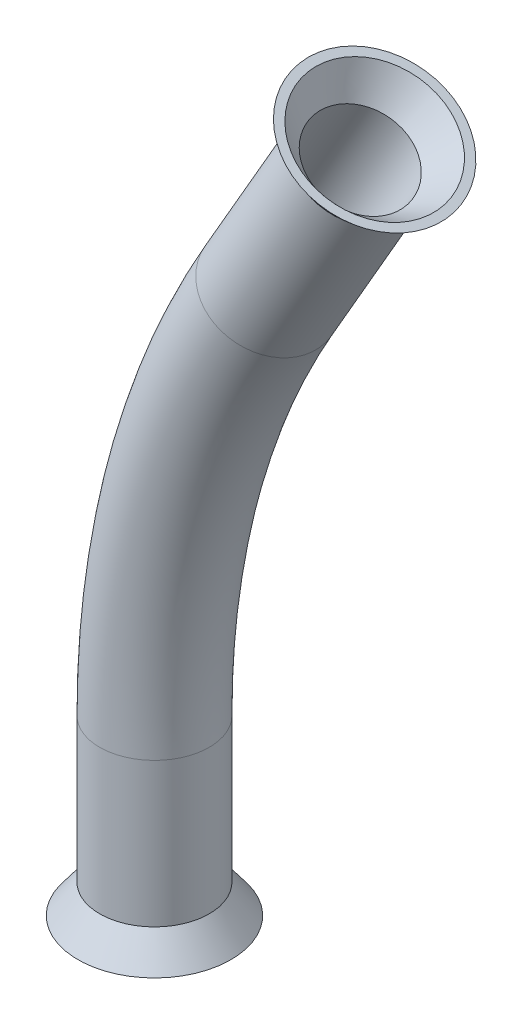
from build123d import *

# Parameters (mm, degrees)
SKETCH1_R           = 4.826
SKETCH1_R_2         = 4.064
SKETCH3_R           = 4.826
BOSS_EXTRUDE1_DEPTH = 2.54
BOSS_EXTRUDE1_DRAFT = -37
SKETCH5_R           = 4.826
BOSS_EXTRUDE2_DEPTH = 2.54
BOSS_EXTRUDE2_DRAFT = -37


with BuildPart() as part:
    # Sweep1: sweep along a path in Sketch2
    with BuildLine(Plane.XY) as sweep1_path:
        Line((0, 0), (0, 12.7))
        ThreePointArc((0, 12.7), (2.549187543, 32.063001763), (10.023027253, 50.106446956))
        Line((10.023027253, 50.106446956), (18.12241613, 64.135))
    # Sketch1 → Sweep1 (sweep)
    with BuildSketch(Plane(origin=(0, 0, 0), x_dir=(1, 0, 0), z_dir=(0, 1, 0))):
        Circle(SKETCH1_R)
        Circle(SKETCH1_R_2, mode=Mode.SUBTRACT)
    sweep(path=sweep1_path.line)


with BuildPart() as boss_extrude1_tool:
    # Sketch3 → Boss-Extrude1 (with draft: the straight prism first)
    with BuildSketch(Plane.XZ):
        with Locations(Location((0, 0, 0), (0, 0, 180))):
            Circle(SKETCH3_R)
    extrude(amount=BOSS_EXTRUDE1_DEPTH)
    # Boss-Extrude1: the draft: its side faces are tilted about the plane it starts from
    boss_extrude1_sides = [boss_extrude1_tool.faces().sort_by_distance(p)[0] for p in [
        (4.826, -1.27, 0),
    ]]
    draft(boss_extrude1_sides, Plane.XZ, BOSS_EXTRUDE1_DRAFT)


with BuildPart() as part_1:
    add(part.part)

    # Boss-Extrude1: add boss_extrude1_tool
    add(boss_extrude1_tool.part)

    # Cut-Extrude1 cone 1 section (through the dimple's axis) → Cut-Extrude1 (revolve, cut)
    with BuildSketch(Plane(origin=(0, -2.54, 0), x_dir=(0, 0, -1), z_dir=(1, 0, 0))):
        Polygon((0, 0), (5.978027287, 0), (0, 7.933110155), align=None)
    revolve(axis=Axis((0, -2.54, 0), (0, 1, 0)), mode=Mode.SUBTRACT)


with BuildPart() as boss_extrude2_tool:
    # Sketch5 → Boss-Extrude2 (with draft: the straight prism first)
    with BuildSketch(Plane(origin=(32.301873668, 55.948486373, 0), x_dir=(0, 0, -1), z_dir=(0.5000000000000008, 0.8660254037844382, 0))):
        with Locations(Location((0, 16.373027253, 0), (0, 0, 90))):
            Circle(SKETCH5_R)
    extrude(amount=BOSS_EXTRUDE2_DEPTH)
    # Boss-Extrude2: the draft: its side faces are tilted about the plane it starts from
    boss_extrude2_sides = [boss_extrude2_tool.faces().sort_by_distance(p)[0] for p in [
        (22.936854729, 62.821852263, 0),
    ]]
    draft(boss_extrude2_sides, Plane(origin=(32.301873668, 55.948486373, 0), x_dir=(0, 0, -1), z_dir=(0.5000000000000008, 0.8660254037844382, 0)), BOSS_EXTRUDE2_DRAFT)


with BuildPart() as part_2:
    add(part_1.part)

    # Boss-Extrude2: add boss_extrude2_tool
    add(boss_extrude2_tool.part)

    # Cut-Extrude2 cone 1 section (through the dimple's axis) → Cut-Extrude2 (revolve, cut)
    with BuildSketch(Plane(origin=(19.39241613, 66.334704526, 0), x_dir=(0, 0, 1), z_dir=(0.866025404, -0.5, 0))):
        Polygon((0, 0), (5.978027287, 0), (0, 7.933110155), align=None)
    revolve(axis=Axis((19.39241613, 66.334704526, 0), (-0.5, -0.866025404, 0)), mode=Mode.SUBTRACT)


solid = part_2.part
